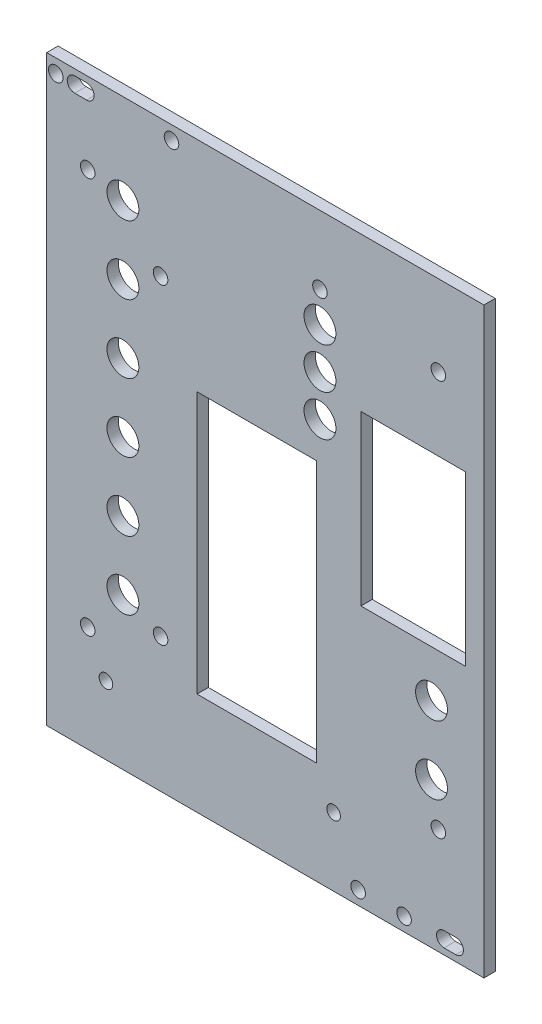
from build123d import *

# Parameters (mm, degrees)
SKETCH1_W           = 96
SKETCH1_H           = 128
BOSS_EXTRUDE1_DEPTH = 2.5
SKETCH2_R           = 1.6
CUT_EXTRUDE1_DEPTH  = 161.019530058
SKETCH3_R           = 1.6
CUT_EXTRUDE2_DEPTH  = 161.019530058
SKETCH4_R           = 1.5
CUT_EXTRUDE3_DEPTH  = 161.019530058
SKETCH9_R           = 1.6
CUT_EXTRUDE4_DEPTH  = 161.019530058
SKETCH12_R          = 3.5
CUT_EXTRUDE5_DEPTH  = 161.019530058
SKETCH13_W          = 23
SKETCH13_H          = 37
SKETCH13_W_2        = 26.25
SKETCH13_H_2        = 57.5
CUT_EXTRUDE6_DEPTH  = 161.019530058


with BuildPart() as part:
    # Sketch1 → Boss-Extrude1 (new body)
    with BuildSketch(Plane.XY):
        with Locations((48, 64)):
            Rectangle(SKETCH1_W, SKETCH1_H)
    extrude(amount=BOSS_EXTRUDE1_DEPTH)

    # Sketch2 → Cut-Extrude1 (cut, through all)
    with BuildSketch(Plane.XY.offset(2.5)):
        with Locations((2, 125)):
            Circle(SKETCH2_R)
        with Locations((27.4, 125)):
            Circle(SKETCH2_R)
        with Locations((78.47, 3)):
            Circle(SKETCH2_R)
        with Locations((68.39, 3)):
            Circle(SKETCH2_R)
        with BuildLine():
            Line((6.15, 126.65), (8.75, 126.65))
            ThreePointArc((8.75, 126.65), (10.4, 125), (8.75, 123.35))
            Line((8.75, 123.35), (6.15, 123.35))
            ThreePointArc((6.15, 123.35), (4.5, 125), (6.15, 126.65))
        make_face()
        with BuildLine():
            Line((87.25, 4.65), (89.85, 4.65))
            ThreePointArc((89.85, 4.65), (91.5, 3), (89.85, 1.35))
            Line((89.85, 1.35), (87.25, 1.35))
            ThreePointArc((87.25, 1.35), (85.6, 3), (87.25, 4.65))
        make_face()
    extrude(amount=-CUT_EXTRUDE1_DEPTH, mode=Mode.SUBTRACT)

    # Sketch3 → Cut-Extrude2 (cut, through all)
    with BuildSketch(Plane.XY.offset(2.5)):
        with Locations((25, 98)):
            Circle(SKETCH3_R)
        with Locations((60, 113)):
            Circle(SKETCH3_R)
        with Locations((25, 29.5)):
            Circle(SKETCH3_R)
    extrude(amount=-CUT_EXTRUDE2_DEPTH, mode=Mode.SUBTRACT)

    # Sketch4 → Cut-Extrude3 (cut, through all)
    with BuildSketch(Plane.XY.offset(2.5)):
        with Locations((13, 15)):
            Circle(SKETCH4_R)
        with Locations((63, 15)):
            Circle(SKETCH4_R)
    extrude(amount=-CUT_EXTRUDE3_DEPTH, mode=Mode.SUBTRACT)

    # Sketch9 → Cut-Extrude4 (cut, through all)
    with BuildSketch(Plane.XY.offset(2.5)):
        with Locations((9, 110.25)):
            Circle(SKETCH9_R)
        with Locations((9, 23.25)):
            Circle(SKETCH9_R)
        with Locations((86, 23.25)):
            Circle(SKETCH9_R)
        with Locations((86, 110.25)):
            Circle(SKETCH9_R)
    extrude(amount=-CUT_EXTRUDE4_DEPTH, mode=Mode.SUBTRACT)

    # Sketch12 → Cut-Extrude5 (cut, through all)
    with BuildSketch(Plane.XY.offset(2.5)):
        with Locations((16.73, 108.25)):
            Circle(SKETCH12_R)
        with Locations((16.73, 93.25)):
            Circle(SKETCH12_R)
        with Locations((16.73, 78.25)):
            Circle(SKETCH12_R)
        with Locations((16.73, 63.25)):
            Circle(SKETCH12_R)
        with Locations((16.73, 48.25)):
            Circle(SKETCH12_R)
        with Locations((16.73, 33.25)):
            Circle(SKETCH12_R)
        with Locations((60, 106.25)):
            Circle(SKETCH12_R)
        with Locations((60, 88.25)):
            Circle(SKETCH12_R)
        with Locations((60, 97.25)):
            Circle(SKETCH12_R)
        with Locations((84.5, 32)):
            Circle(SKETCH12_R)
        with Locations((84.5, 47)):
            Circle(SKETCH12_R)
    extrude(amount=-CUT_EXTRUDE5_DEPTH, mode=Mode.SUBTRACT)

    # Sketch13 → Cut-Extrude6 (cut, through all)
    with BuildSketch(Plane.XY.offset(2.5)):
        with Locations((80.5, 75.75)):
            Rectangle(SKETCH13_W, SKETCH13_H)
        with Locations((46.125, 51.25)):
            Rectangle(SKETCH13_W_2, SKETCH13_H_2)
    extrude(amount=-CUT_EXTRUDE6_DEPTH, mode=Mode.SUBTRACT)


solid = part.part
